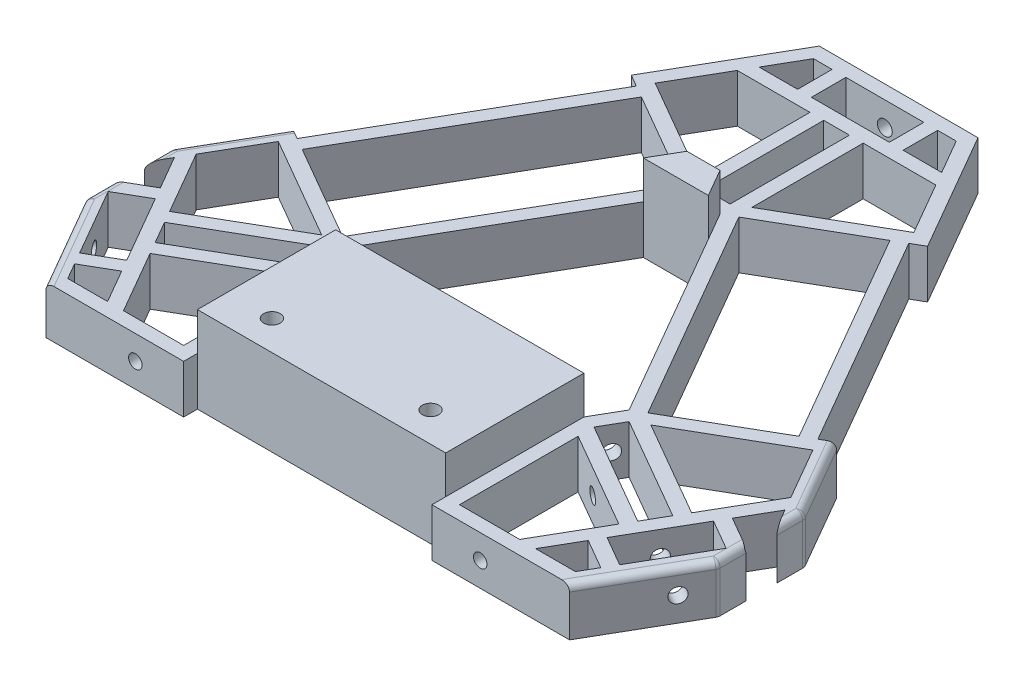
from build123d import *

# Parameters (mm, degrees)
EXTRUDE_1_DEPTH     = 7
EXTRUDE_2_DEPTH     = 7
EXTRUDE_3_DEPTH     = 7
CUT_EXTRUDE_1_REACH = 122.249
SKETCH_5_R          = 1.075
CUT_EXTRUDE_2_REACH = 101.166
SKETCH_6_R          = 1.075
CUT_EXTRUDE_3_REACH = 122.249
SKETCH_7_R          = 1.075
SKETCH_8_W          = 36
SKETCH_8_H          = 16.035898384
EXTRUDE_4_DEPTH     = 7
SKETCH_9_W          = 36
SKETCH_9_H          = 20.035898384
EXTRUDE_5_DEPTH     = 5.5
SKETCH_10_R         = 1.2
CUT_EXTRUDE_4_DEPTH = 72.760416725
FILLET_1_R          = 8
SKETCH_12_W         = 8.3
SKETCH_12_H         = 24.649880383
CUT_EXTRUDE_6_DEPTH = 71.152809904
FILLET_2_R          = 1
SKETCH_13_R         = 2.5
CUT_EXTRUDE_7_DEPTH = 3
EXTRUDE_6_DEPTH     = 12.5
SKETCH_16_R         = 0.975
CUT_EXTRUDE_8_DEPTH = 20


with BuildPart() as part:
    # ｽｹｯﾁ1 → ﾎﾞｽ - 押し出し1 (new body)
    with BuildSketch(Plane(origin=(0, 0, 0), x_dir=(1, 0, 0), z_dir=(0, 1, 0))):
        Polygon((-18, -33.197640478), (18, -33.197640478), (18, -35.197640478), (37.954700538, -35.197640478), (49.459401077, -15.27091462), (39.482050808, 2.010362971), (37.75, 1.010362971), (19.75, 32.187277507), (21.482050808, 33.187277507), (11.504700538, 50.468555098), (-11.504700538, 50.468555098), (-21.482050808, 33.187277507), (-19.75, 32.187277507), (-37.75, 1.010362971), (-39.482050808, 2.010362971), (-49.459401077, -15.27091462), (-37.954700538, -35.197640478), (-18, -35.197640478), align=None)
        Polygon((-10.35, 48.468555098), (10.35, 48.468555098), (18.75, 33.919328315), (17.017949192, 32.919328315), (37.017949192, -1.721687836), (38.75, -0.721687836), (47.15, -15.27091462), (36.8, -33.197640478), (20, -33.197640478), (20, -31.197640478), (-20, -31.197640478), (-20, -33.197640478), (-36.8, -33.197640478), (-47.15, -15.27091462), (-38.75, -0.721687836), (-37.017949192, -1.721687836), (-17.017949192, 32.919328315), (-18.75, 33.919328315), align=None, mode=Mode.SUBTRACT)
    extrude(amount=EXTRUDE_1_DEPTH)

    # ｽｹｯﾁ3 → ﾎﾞｽ - 押し出し2 (add)
    with BuildSketch(Plane.XZ):
        Polygon((-20, 13.697640478), (-20, 31.197640478), (-18, 31.197640478), (-18, 15.161742094), (18, 15.161742094), (18, 31.197640478), (20, 31.197640478), (20, 13.697640478), (21.862504626, 10.471687836), (37.017949192, 1.721687836), (36.017949192, -0.010362971), (22.130453819, 8.007586221), (4.130453819, -23.169328315), (18.017949192, -31.187277507), (17.017949192, -32.919328315), (1.862504626, -24.169328315), (-1.862504626, -24.169328315), (-17.017949192, -32.919328315), (-18.017949192, -31.187277507), (-4.130453819, -23.169328315), (-22.130453819, 8.007586221), (-36.017949192, -0.010362971), (-37.017949192, 1.721687836), (-21.862504626, 10.471687836), align=None)
        Polygon((-20.398403011, 9.007586221), (-18, 13.161742094), (18, 13.161742094), (20.398403011, 9.007586221), (2.398403011, -22.169328315), (-2.398403011, -22.169328315), align=None, mode=Mode.SUBTRACT)
    extrude(amount=-EXTRUDE_2_DEPTH)

    # ｽｹｯﾁ4 → ﾎﾞｽ - 押し出し3 (add)
    with BuildSketch(Plane.XZ):
        Polygon((31.026497308, 33.197640478), (33.819872981, 28.359371888), (38.15, 30.859371888), (39.15, 29.127321081), (34.819872981, 26.627321081), (40.469872981, 16.841234018), (44.8, 19.341234018), (45.8, 17.60918321), (41.469872981, 15.10918321), (44.263248654, 10.27091462), (43.108548116, 8.27091462), (37.844074487, 17.389250421), (23.862504626, 9.316987298), (21.862504626, 10.471687836), (36.844074487, 19.121301228), (34.98156986, 22.34725387), (20, 13.697640478), (20, 16.007041555), (33.98156986, 24.079304678), (28.717096231, 33.197640478), align=None)
        Polygon((-31.026497308, 33.197640478), (-28.717096231, 33.197640478), (-33.98156986, 24.079304678), (-20, 16.007041555), (-20, 13.697640478), (-34.98156986, 22.34725387), (-36.844074487, 19.121301228), (-21.862504626, 10.471687836), (-23.862504626, 9.316987298), (-37.844074487, 17.389250421), (-43.108548116, 8.27091462), (-44.263248654, 10.27091462), (-41.469872981, 15.10918321), (-45.8, 17.60918321), (-44.8, 19.341234018), (-40.469872981, 16.841234018), (-34.819872981, 26.627321081), (-39.15, 29.127321081), (-38.15, 30.859371888), (-33.819872981, 28.359371888), align=None)
        Polygon((-14.391451884, -41.468555098), (-3.862504626, -41.468555098), (-3.862504626, -25.324028853), (-1.862504626, -24.169328315), (-1.862504626, -41.468555098), (1.862504626, -41.468555098), (1.862504626, -24.169328315), (3.862504626, -25.324028853), (3.862504626, -41.468555098), (14.391451884, -41.468555098), (13.236751346, -43.468555098), (7.65, -43.468555098), (7.65, -48.468555098), (5.65, -48.468555098), (5.65, -43.468555098), (-5.65, -43.468555098), (-5.65, -48.468555098), (-7.65, -48.468555098), (-7.65, -43.468555098), (-13.236751346, -43.468555098), align=None)
    extrude(amount=-EXTRUDE_3_DEPTH)

    # ｶｯﾄ - 押し出し1: up to this face of the body (flat: up to its plane)
    cut_extrude_1_end = Plane(part.part.faces().sort_by_distance((19.199201506, 3.5, 11.084664157))[0])
    # ｽｹｯﾁ5 → ｶｯﾄ - 押し出し1 (cut, up to the picked face)
    with BuildSketch(Plane(origin=(43.707050808, 0, 25.234277549), x_dir=(0.5, 0, -0.8660254037844386), z_dir=(0.8660254037844387, 0, 0.5000000000000001)), mode=Mode.PRIVATE) as cut_extrude_1_sk1:
        with Locations((0, 3.5)):
            Circle(SKETCH_5_R)
    cut_extrude_1_tool1 = split(extrude(cut_extrude_1_sk1.sketch, amount=-CUT_EXTRUDE_1_REACH, mode=Mode.PRIVATE), bisect_by=cut_extrude_1_end, keep=Keep.BOTH, mode=Mode.PRIVATE)
    add(cut_extrude_1_tool1.solids().sort_by(Axis((43.707051, 3.5, 25.234278), (-0.8660254037844387, 0, -0.5000000000000001)))[0], mode=Mode.SUBTRACT)

    # ｶｯﾄ - 押し出し2: up to this face of the body (flat: up to its plane)
    cut_extrude_2_end = Plane(part.part.faces().sort_by_distance((0, 3.5, -22.169328315))[0])
    # ｽｹｯﾁ6 → ｶｯﾄ - 押し出し2 (cut, up to the picked face)
    with BuildSketch(Plane(origin=(0, 0, -50.468555098), x_dir=(-1, 0, 0), z_dir=(0, 0, -1)), mode=Mode.PRIVATE) as cut_extrude_2_sk1:
        with Locations((0, 3.5)):
            Circle(SKETCH_6_R)
    cut_extrude_2_tool1 = split(extrude(cut_extrude_2_sk1.sketch, amount=-CUT_EXTRUDE_2_REACH, mode=Mode.PRIVATE), bisect_by=cut_extrude_2_end, keep=Keep.BOTH, mode=Mode.PRIVATE)
    add(cut_extrude_2_tool1.solids().sort_by(Axis((0, 3.5, -50.468555), (0, 0, 1)))[0], mode=Mode.SUBTRACT)

    # ｶｯﾄ - 押し出し3: up to this face of the body (flat: up to its plane)
    cut_extrude_3_end = Plane(part.part.faces().sort_by_distance((-19.199201506, 3.5, 11.084664157))[0])
    # ｽｹｯﾁ7 → ｶｯﾄ - 押し出し3 (cut, up to the picked face)
    with BuildSketch(Plane(origin=(-43.707050808, 0, 25.234277549), x_dir=(0.5000000000000001, 0, 0.8660254037844386), z_dir=(-0.8660254037844386, 0, 0.5000000000000001)), mode=Mode.PRIVATE) as cut_extrude_3_sk1:
        with Locations((0, 3.5)):
            Circle(SKETCH_7_R)
    cut_extrude_3_tool1 = split(extrude(cut_extrude_3_sk1.sketch, amount=-CUT_EXTRUDE_3_REACH, mode=Mode.PRIVATE), bisect_by=cut_extrude_3_end, keep=Keep.BOTH, mode=Mode.PRIVATE)
    add(cut_extrude_3_tool1.solids().sort_by(Axis((-43.707051, 3.5, 25.234278), (0.8660254037844386, 0, -0.5000000000000001)))[0], mode=Mode.SUBTRACT)

    # ｽｹｯﾁ8 → ﾎﾞｽ - 押し出し4 (add)
    with BuildSketch(Plane(origin=(0, 7, 0), x_dir=(1, 0, 0), z_dir=(0, 1, 0))):
        with Locations((0, -23.179691286)):
            Rectangle(SKETCH_8_W, SKETCH_8_H)
    extrude(amount=-EXTRUDE_4_DEPTH)

    # ｽｹｯﾁ9 → ﾎﾞｽ - 押し出し5 (add)
    with BuildSketch(Plane(origin=(0, 7, 0), x_dir=(1, 0, 0), z_dir=(0, 1, 0))):
        with Locations((0, -23.179691286)):
            Rectangle(SKETCH_9_W, SKETCH_9_H)
    extrude(amount=EXTRUDE_5_DEPTH)

    # ｽｹｯﾁ10 → ｶｯﾄ - 押し出し4 (cut, through all)
    with BuildSketch(Plane(origin=(0, 12.5, 0), x_dir=(1, 0, 0), z_dir=(0, 1, 0))):
        with Locations(Location((-11.5, -28.897640478, 0), (0, 0, 270))):
            Circle(SKETCH_10_R)
        with Locations(Location((11.5, -28.897640478, 0), (0, 0, 270))):
            Circle(SKETCH_10_R)
    extrude(amount=-CUT_EXTRUDE_4_DEPTH, mode=Mode.SUBTRACT)

    # ﾌｨﾚｯﾄ1
    fillet_1_edges = [part.edges().sort_by_distance(p)[0] for p in [
        (-49.459401077, 3.5, 15.27091462),
        (49.459401077, 3.5, 15.27091462),
    ]]
    fillet(fillet_1_edges, radius=FILLET_1_R)

    # ｽｹｯﾁ12 → ｶｯﾄ - 押し出し6 (cut, through all)
    with BuildSketch(Plane(origin=(0, 7, 0), x_dir=(1, 0, 0), z_dir=(0, 1, 0))):
        with Locations((-50, -9.197640479)):
            Rectangle(SKETCH_12_W, SKETCH_12_H)
        with Locations((50, -9.197640479)):
            Rectangle(SKETCH_12_W, SKETCH_12_H)
    extrude(amount=-CUT_EXTRUDE_6_DEPTH, mode=Mode.SUBTRACT)

    # ﾌｨﾚｯﾄ2
    fillet_2_edges = [part.edges().sort_by_distance(p)[0] for p in [
        (42.666025404, 7, 3.5044428),
        (45.85, 3.5, 9.01924857),
        (45.85, 7, 11.01924857),
        (45.85, 7, 19.52258067),
        (45.85, 3.5, 21.52258067),
        (41.902350269, 7, 28.360110574),
        (-41.902350269, 7, 28.360110574),
        (-45.85, 7, 19.52258067),
        (-45.85, 3.5, 21.52258067),
        (-45.85, 3.5, 9.01924857),
        (-42.666025404, 7, 3.5044428),
        (-45.85, 7, 11.01924857),
    ]]
    fillet(fillet_2_edges, radius=FILLET_2_R)

    # ｽｹｯﾁ13 → ｶｯﾄ - 押し出し7 (cut)
    with BuildSketch(Plane.XZ):
        with Locations(Location((11.5, 28.897640478, 0), (0, 0, 270))):
            Circle(SKETCH_13_R)
        with Locations(Location((-11.5, 28.897640478, 0), (0, 0, 270))):
            Circle(SKETCH_13_R)
    extrude(amount=-CUT_EXTRUDE_7_DEPTH, mode=Mode.SUBTRACT)

    # ｽｹｯﾁ15 → ﾎﾞｽ - 押し出し6 (add)
    with BuildSketch(Plane.XZ):
        Polygon((2.398403011, -22.169328315), (4.707804088, -18.169328315), (-4.707804088, -18.169328315), (-2.398403011, -22.169328315), align=None)
    extrude(amount=-EXTRUDE_6_DEPTH)

    # ｽｹｯﾁ16 → ｶｯﾄ - 押し出し8 (cut)
    with BuildSketch(Plane.XY.offset(35.197640478)):
        with Locations(Location((-25, 3.5, 0), (0, 0, 180))):
            Circle(SKETCH_16_R)
        with Locations((25, 3.5)):
            Circle(SKETCH_16_R)
    extrude(amount=-CUT_EXTRUDE_8_DEPTH, mode=Mode.SUBTRACT)


solid = part.part
